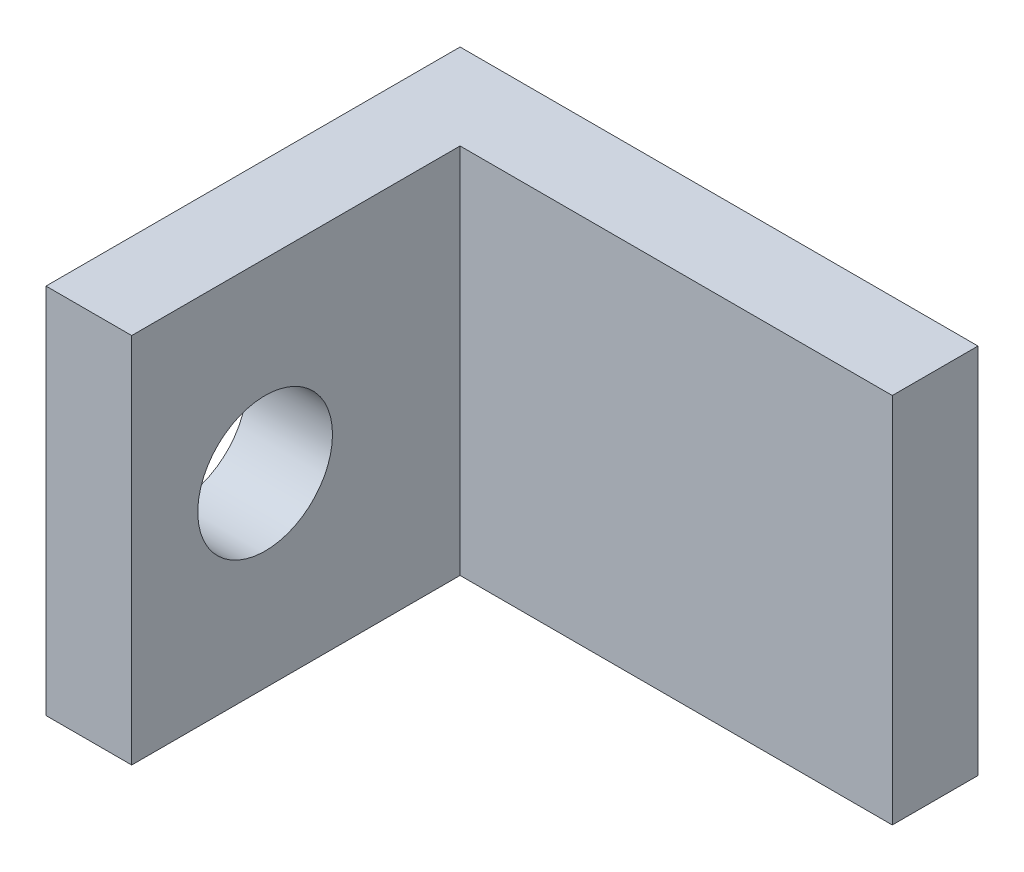
from build123d import *

# Parameters (mm, degrees)
BOSS_EXTRUDE1_START = -3.18
SKETCH1_W           = 16.037750947
SKETCH1_H           = 13.801978015
BOSS_EXTRUDE1_DEPTH = 3.18
SKETCH3_W           = 15.364094043
SKETCH3_H           = 13.801978015
SKETCH3_R           = 2.5
BOSS_EXTRUDE2_DEPTH = 3.18


with BuildPart() as part:
    # Sketch1 → Boss-Extrude1 (new body)
    with BuildSketch(Plane.XY.offset(BOSS_EXTRUDE1_START)):
        with Locations((15.890651203, -26.571727946)):
            Rectangle(SKETCH1_W, SKETCH1_H)
    extrude(amount=-BOSS_EXTRUDE1_DEPTH)

    # Sketch3 → Boss-Extrude2 (add)
    with BuildSketch(Plane.ZY.offset(-7.871775729)):
        with Locations((1.322047021, -26.571727946)):
            Rectangle(SKETCH3_W, SKETCH3_H)
        with Locations(Location((4.053672899, -26.571727946, 0), (0, 0, 180))):
            Circle(SKETCH3_R, mode=Mode.SUBTRACT)
    extrude(amount=BOSS_EXTRUDE2_DEPTH)


solid = part.part
